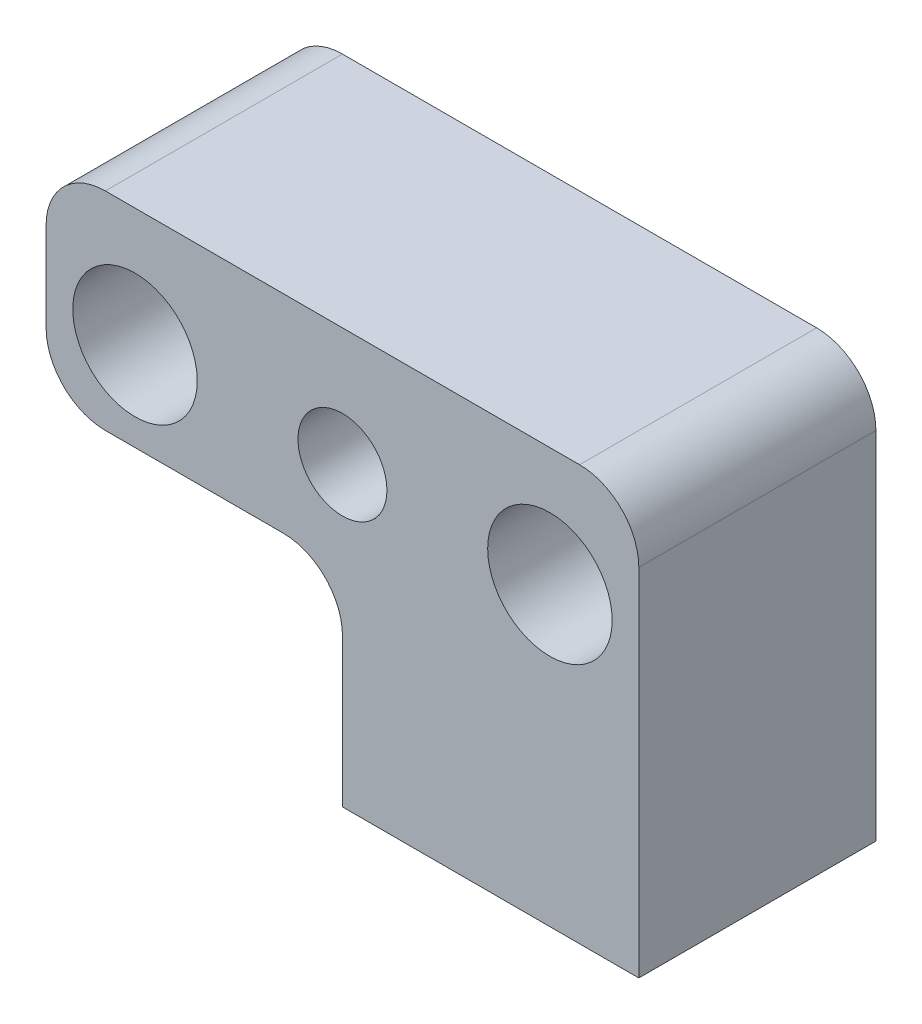
from build123d import *

# Parameters (mm, degrees)
SKETCH1_W               = 100
SKETCH1_H               = 80
BOSS_EXTRUDE1_DEPTH     = 40
CUT_EXTRUDE1_REACH      = 77.498
SKETCH2_R               = 7.5
SKETCH2_R_2             = 10.5
CUT_EXTRUDE2_REACH      = 77.498
SKETCH3_W               = 100
SKETCH3_H               = 20
CUT_EXTRUDE3_DEPTH      = 50
CUT_EXTRUDE3_DEPTH_BACK = 25
SKETCH4_R               = 3
CUT_EXTRUDE4_REACH      = 77.498
SKETCH5_W               = 50
SKETCH5_H               = 25
FILLET1_R               = 10
FILLET2_R               = 10
FILLET3_R               = 10
FILLET4_R               = 10
SKETCH6_W               = 50
SKETCH6_H               = 40
SKETCH6_W_2             = 40
SKETCH6_H_2             = 30
BOSS_EXTRUDE2_DEPTH     = 10


with BuildPart() as part:
    # Sketch1 → Boss-Extrude1 (new body)
    with BuildSketch(Plane.XY):
        Rectangle(SKETCH1_W, SKETCH1_H)
    extrude(amount=BOSS_EXTRUDE1_DEPTH)

    # Sketch2 → Cut-Extrude1 (cut, up to next)
    with BuildSketch(Plane.XY.offset(40), mode=Mode.PRIVATE) as cut_extrude1_sk1:
        Circle(SKETCH2_R)
    cut_extrude1_tool1 = extrude(cut_extrude1_sk1.sketch, amount=-CUT_EXTRUDE1_REACH, mode=Mode.PRIVATE) & part.part
    # Sketch2 → Cut-Extrude1 (cut, up to next)
    with BuildSketch(Plane.XY.offset(40), mode=Mode.PRIVATE) as cut_extrude1_sk2:
        with Locations((-35, 0)):
            Circle(SKETCH2_R_2)
    cut_extrude1_tool2 = extrude(cut_extrude1_sk2.sketch, amount=-CUT_EXTRUDE1_REACH, mode=Mode.PRIVATE) & part.part
    # Sketch2 → Cut-Extrude1 (cut, up to next)
    with BuildSketch(Plane.XY.offset(40), mode=Mode.PRIVATE) as cut_extrude1_sk3:
        with Locations((35, 0)):
            Circle(SKETCH2_R_2)
    cut_extrude1_tool3 = extrude(cut_extrude1_sk3.sketch, amount=-CUT_EXTRUDE1_REACH, mode=Mode.PRIVATE) & part.part
    add(cut_extrude1_tool1.solids().sort_by_distance((0, 0, 40))[0], mode=Mode.SUBTRACT)
    add(cut_extrude1_tool2.solids().sort_by_distance((-35, 0, 40))[0], mode=Mode.SUBTRACT)
    add(cut_extrude1_tool3.solids().sort_by_distance((35, 0, 40))[0], mode=Mode.SUBTRACT)

    # Sketch3 → Cut-Extrude2 (cut, up to next)
    with BuildSketch(Plane.XY.offset(40), mode=Mode.PRIVATE) as cut_extrude2_sk1:
        with Locations((0, 30)):
            Rectangle(SKETCH3_W, SKETCH3_H)
    cut_extrude2_tool1 = extrude(cut_extrude2_sk1.sketch, amount=-CUT_EXTRUDE2_REACH, mode=Mode.PRIVATE) & part.part
    add(cut_extrude2_tool1.solids().sort_by_distance((0, 30, 40))[0], mode=Mode.SUBTRACT)

    # Sketch4 → Cut-Extrude3 (cut, two sides: drawn at the far end of the back side and taken through both)
    with BuildSketch(Plane.XZ.offset(40).offset(-CUT_EXTRUDE3_DEPTH_BACK)):
        with Locations(Location((16, 20, 0), (0, 0, 180))):
            Circle(SKETCH4_R)
        with Locations(Location((36, 20, 0), (0, 0, 180))):
            Circle(SKETCH4_R)
    extrude(amount=CUT_EXTRUDE3_DEPTH + CUT_EXTRUDE3_DEPTH_BACK, mode=Mode.SUBTRACT)

    # Sketch5 → Cut-Extrude4 (cut, up to next)
    with BuildSketch(Plane(origin=(0, 0, 0), x_dir=(-1, 0, 0), z_dir=(0, 0, -1)), mode=Mode.PRIVATE) as cut_extrude4_sk1:
        with Locations((25, -27.5)):
            Rectangle(SKETCH5_W, SKETCH5_H)
    cut_extrude4_tool1 = extrude(cut_extrude4_sk1.sketch, amount=-CUT_EXTRUDE4_REACH, mode=Mode.PRIVATE) & part.part
    add(cut_extrude4_tool1.solids().sort_by_distance((-25, -27.5, 0))[0], mode=Mode.SUBTRACT)

    # Fillet1
    fillet1_edges = [part.edges().sort_by_distance(p)[0] for p in [
        (0, -15, 20),
    ]]
    fillet(fillet1_edges, radius=FILLET1_R)

    # Fillet2
    fillet2_edges = [part.edges().sort_by_distance(p)[0] for p in [
        (-50, -15, 20),
    ]]
    fillet(fillet2_edges, radius=FILLET2_R)

    # Fillet3
    fillet3_edges = [part.edges().sort_by_distance(p)[0] for p in [
        (-50, 20, 20),
    ]]
    fillet(fillet3_edges, radius=FILLET3_R)

    # Fillet4
    fillet4_edges = [part.edges().sort_by_distance(p)[0] for p in [
        (50, 20, 20),
    ]]
    fillet(fillet4_edges, radius=FILLET4_R)

    # Sketch6 → Boss-Extrude2 (add)
    with BuildSketch(Plane.XZ.offset(40)):
        with Locations((25, 20)):
            Rectangle(SKETCH6_W, SKETCH6_H)
        with Locations((25, 20)):
            Rectangle(SKETCH6_W_2, SKETCH6_H_2, mode=Mode.SUBTRACT)
    extrude(amount=BOSS_EXTRUDE2_DEPTH)


solid = part.part
